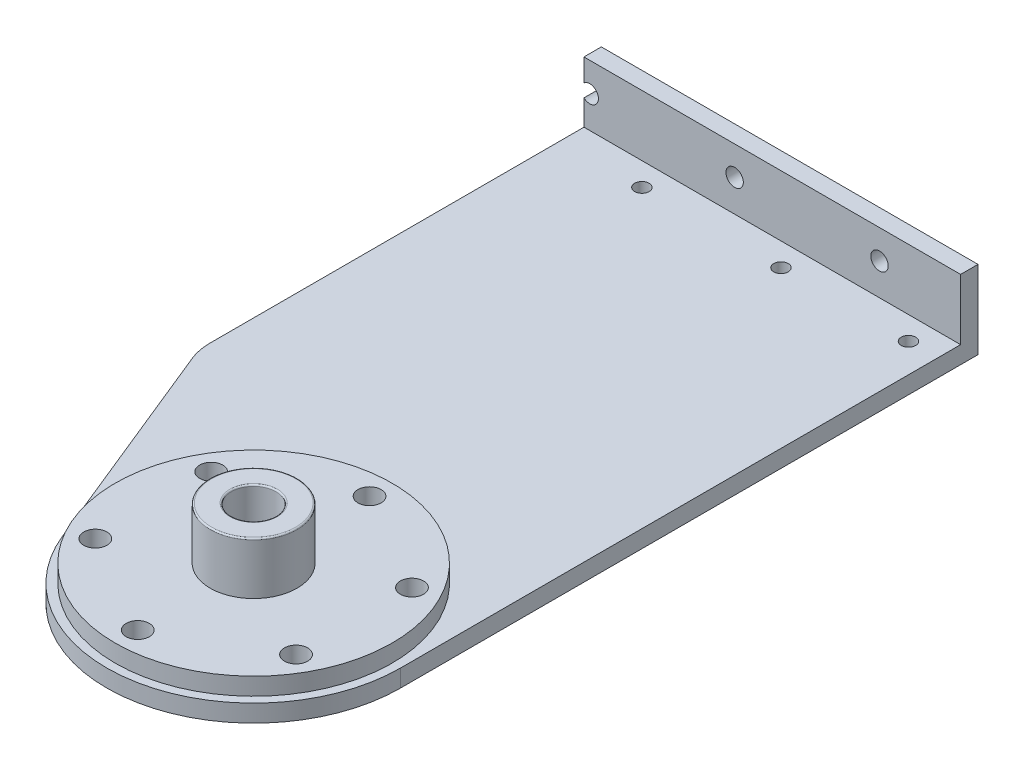
from build123d import *

# Parameters (mm, degrees)
ESBO_O1_R                = 7.5
ESBO_O1_R_2              = 2
ESBO_O1_R_3              = 1.25
RESSALTO_EXTRUS_O1_DEPTH = 3
RESSALTO_EXTRUS_O2_START = 3
ESBO_O1_3_R              = 23.9
ESBO_O1_3_R_2            = 2
ESBO_O1_3_R_3            = 3.85
RESSALTO_EXTRUS_O2_DEPTH = 3
RESSALTO_EXTRUS_O3_START = 12
ESBO_O1_4_R              = 7.5
ESBO_O1_4_R_2            = 3.85
RESSALTO_EXTRUS_O3_DEPTH = 12
FILETE1_R                = 0.25
ESBO_O2_W                = 65
ESBO_O2_H                = 13.5
RESSALTO_EXTRUS_O4_DEPTH = 3
ESBO_O4_R                = 1.5
CORTE_EXTRUS_O1_DEPTH    = 3


with BuildPart() as part:
    # Esboço1 → Ressalto-extrusão1 (new body)
    with BuildSketch(Plane(origin=(0, 0, 0), x_dir=(1, 0, 0), z_dir=(0, 1, 0))):
        with BuildLine():
            Line((-39.65, 96.65), (25.35, 96.65))
            Line((25.35, 96.65), (25.35, 0))
            ThreePointArc((25.35, 0), (4.871403095, -24.877538702), (-23.477765829, -9.561224382))
            Line((-23.477765829, -9.561224382), (-38.911446086, 28.336467011))
            ThreePointArc((-38.911446086, 28.336467011), (-39.463624735, 30.186495131), (-39.65, 32.108153157))
            Line((-39.65, 32.108153157), (-39.65, 96.65))
        make_face()
        with Locations(Location((0, 0, 0), (0, 0, 270))):
            Circle(ESBO_O1_R, mode=Mode.SUBTRACT)
        with Locations(Location((0, 20, 0), (0, 0, 270))):
            Circle(ESBO_O1_R_2, mode=Mode.SUBTRACT)
        with Locations(Location((17.320508076, 10, 0), (0, 0, 270))):
            Circle(ESBO_O1_R_2, mode=Mode.SUBTRACT)
        with Locations(Location((17.320508076, -10, 0), (0, 0, 270))):
            Circle(ESBO_O1_R_2, mode=Mode.SUBTRACT)
        with Locations(Location((0, -20, 0), (0, 0, 270))):
            Circle(ESBO_O1_R_2, mode=Mode.SUBTRACT)
        with Locations(Location((-17.320508076, -10, 0), (0, 0, 270))):
            Circle(ESBO_O1_R_2, mode=Mode.SUBTRACT)
        with Locations(Location((-17.320508076, 10, 0), (0, 0, 270))):
            Circle(ESBO_O1_R_2, mode=Mode.SUBTRACT)
        with Locations(Location((20.35, 92.65, 0), (0, 0, 270))):
            Circle(ESBO_O1_R_3, mode=Mode.SUBTRACT)
        with Locations(Location((-1.65, 92.65, 0), (0, 0, 270))):
            Circle(ESBO_O1_R_3, mode=Mode.SUBTRACT)
        with Locations(Location((-25.65, 92.65, 0), (0, 0, 270))):
            Circle(ESBO_O1_R_3, mode=Mode.SUBTRACT)
    extrude(amount=-RESSALTO_EXTRUS_O1_DEPTH)

    # Esboço1<3> → Ressalto-extrusão2 (add)
    with BuildSketch(Plane(origin=(0, 0, 0), x_dir=(1, 0, 0), z_dir=(0, 1, 0)).offset(RESSALTO_EXTRUS_O2_START)):
        with Locations(Location((0, 0, 0), (0, 0, 270))):
            Circle(ESBO_O1_3_R)
        with Locations(Location((-17.320508076, -10, 0), (0, 0, 270))):
            Circle(ESBO_O1_3_R_2, mode=Mode.SUBTRACT)
        with Locations(Location((-17.320508076, 10, 0), (0, 0, 270))):
            Circle(ESBO_O1_3_R_2, mode=Mode.SUBTRACT)
        with Locations(Location((0, -20, 0), (0, 0, 270))):
            Circle(ESBO_O1_3_R_2, mode=Mode.SUBTRACT)
        with Locations(Location((17.320508076, -10, 0), (0, 0, 270))):
            Circle(ESBO_O1_3_R_2, mode=Mode.SUBTRACT)
        with Locations(Location((0, 20, 0), (0, 0, 270))):
            Circle(ESBO_O1_3_R_2, mode=Mode.SUBTRACT)
        with Locations(Location((17.320508076, 10, 0), (0, 0, 270))):
            Circle(ESBO_O1_3_R_2, mode=Mode.SUBTRACT)
        with Locations(Location((0, 0, 0), (0, 0, 270))):
            Circle(ESBO_O1_3_R_3, mode=Mode.SUBTRACT)
    extrude(amount=-RESSALTO_EXTRUS_O2_DEPTH)

    # Esboço1<4> → Ressalto-extrusão3 (add)
    with BuildSketch(Plane(origin=(0, 0, 0), x_dir=(1, 0, 0), z_dir=(0, 1, 0)).offset(RESSALTO_EXTRUS_O3_START)):
        with Locations(Location((0, 0, 0), (0, 0, 270))):
            Circle(ESBO_O1_4_R)
        with Locations(Location((0, 0, 0), (0, 0, 270))):
            Circle(ESBO_O1_4_R_2, mode=Mode.SUBTRACT)
    extrude(amount=-RESSALTO_EXTRUS_O3_DEPTH)

    # Filete1
    filete1_edges = [part.edges().sort_by_distance(p)[0] for p in [
        (0, 12, -3.85),
        (0, 12, -7.5),
    ]]
    fillet(filete1_edges, radius=FILETE1_R)

    # Esboço2 → Ressalto-extrusão4 (add)
    with BuildSketch(Plane(origin=(0, 0, -96.65), x_dir=(-1, 0, 0), z_dir=(0, 0, -1))):
        with Locations((7.15, 3.75)):
            Rectangle(ESBO_O2_W, ESBO_O2_H)
    extrude(amount=RESSALTO_EXTRUS_O4_DEPTH)

    # Esboço4 → Corte-extrusão1 (cut)
    with BuildSketch(Plane(origin=(0, 0, -99.65), x_dir=(-1, 0, 0), z_dir=(0, 0, -1))):
        with Locations((-11.35, 5.5)):
            Circle(ESBO_O4_R)
        with Locations((13.65, 5.5)):
            Circle(ESBO_O4_R)
        with Locations((38.65, 5.5)):
            Circle(ESBO_O4_R)
    extrude(amount=-CORTE_EXTRUS_O1_DEPTH, mode=Mode.SUBTRACT)


solid = part.part
